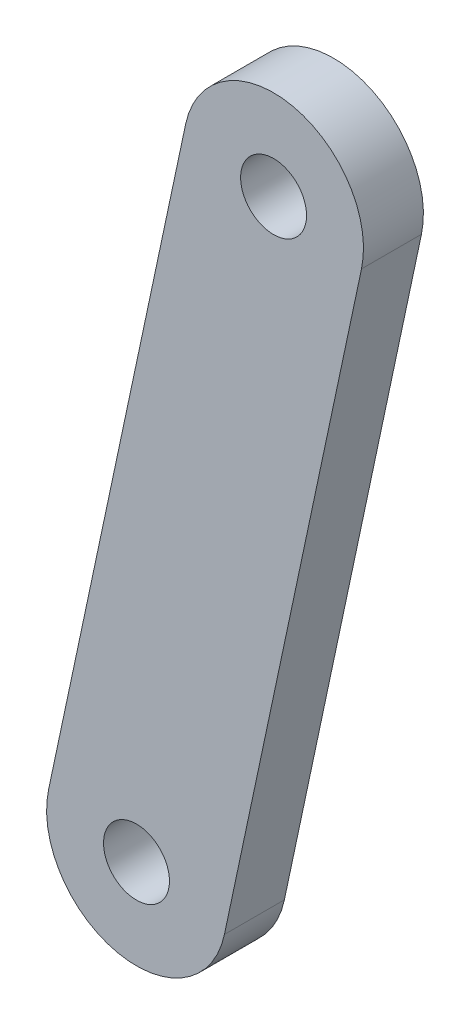
from build123d import *

# Parameters (mm, degrees)
PLASTINA_DEPTH        = 3
OTVERSTIYA_DEPTH      = 62.362552644
OTVERSTIYA_DEPTH_BACK = 62.362552644
ESKIZ_OTVERSTIYA_R    = 1.65


with BuildPart() as part:
    # Eskiz_kontur → Plastina (new body)
    with BuildSketch(Plane.XY):
        with BuildLine():
            Line((17.26275, 53.34327), (10.40166, 21.0644))
            ThreePointArc((10.40166, 21.0644), (5.0644, 17.59834), (1.59834, 22.9356))
            Line((1.59834, 22.9356), (8.45942, 55.21447))
            ThreePointArc((8.45942, 55.21447), (13.796685, 58.680535), (17.26275, 53.34327))
        make_face()
    extrude(amount=PLASTINA_DEPTH)

    # Eskiz_otverstiya → Otverstiya (cut, two sides: drawn at the far end of the back side and taken through both)
    with BuildSketch(Plane.XY.offset(-OTVERSTIYA_DEPTH_BACK)):
        with Locations((6, 22)):
            Circle(ESKIZ_OTVERSTIYA_R)
        with Locations((12.86109, 54.27887)):
            Circle(ESKIZ_OTVERSTIYA_R)
    extrude(amount=OTVERSTIYA_DEPTH + OTVERSTIYA_DEPTH_BACK, mode=Mode.SUBTRACT)


solid = part.part
